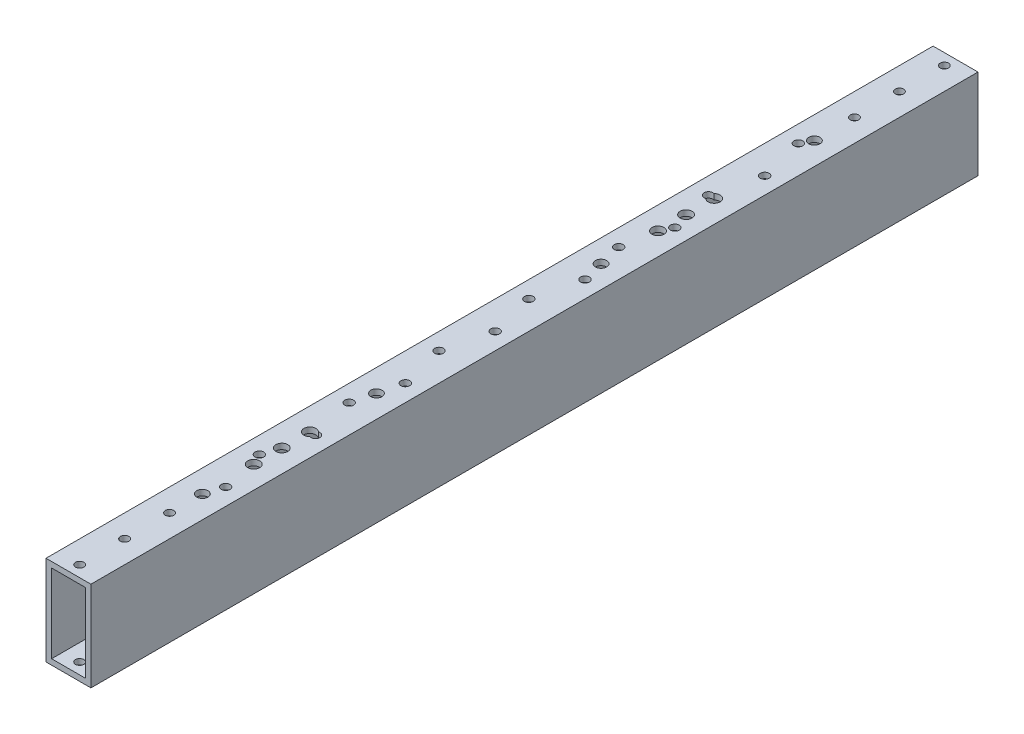
from build123d import *

# Parameters (mm, degrees)
SKETCH1_W                       = 25.4
SKETCH1_H                       = 50.8
SKETCH1_W_2                     = 19.05
SKETCH1_H_2                     = 44.45
EXTRUDE_THIN1_DEPTH             = 501.65
F_3_16_0_1875_DIAMETER_HOLE1_D  = 4.7625
F_1_4_0_25_DIAMETER_HOLE1_D     = 6.35
F_1_4_0_25_DIAMETER_HOLE1_DEPTH = 25.4
F_1_4_0_25_DIAMETER_HOLE1_TIP   = 1.907732465
F_1_4_CLEARANCE_HOLE1_D         = 6.7564
F_1_4_CLEARANCE_HOLE1_DEPTH     = 38.1
F_1_4_CLEARANCE_HOLE1_TIP       = 2.029827343
F_3_16_0_195_DIAMETER_HOLE1_D   = 4.953


with BuildPart() as part:
    # Sketch1 → Extrude-Thin1 (new body)
    with BuildSketch(Plane.XY):
        Rectangle(SKETCH1_W, SKETCH1_H)
        Rectangle(SKETCH1_W_2, SKETCH1_H_2, mode=Mode.SUBTRACT)
    extrude(amount=EXTRUDE_THIN1_DEPTH)

    # 3/16 (0.1875) Diameter Hole1 (through all)
    with Locations(Plane(origin=(0, 25.4, 495.3), x_dir=(1, 0, 0), z_dir=(0, 1, 0))):
        with Locations((0, 0), (0, 488.95), (0, 463.55), (0, 438.15), (0, 25.4), (0, 50.8)):
            Hole(F_3_16_0_1875_DIAMETER_HOLE1_D / 2)

    # 1/4 (0.25) Diameter Hole1
    with Locations(Plane(origin=(0, 25.4, 0), x_dir=(1, 0, 0), z_dir=(0, 1, 0))):
        with Locations((0, -79.831), (0, -425.933853021), (0, -327.499040355), (0, -200.481)):
            Hole(F_1_4_0_25_DIAMETER_HOLE1_D / 2, depth=F_1_4_0_25_DIAMETER_HOLE1_DEPTH)
            with Locations((0, 0, -(F_1_4_0_25_DIAMETER_HOLE1_DEPTH + F_1_4_0_25_DIAMETER_HOLE1_TIP / 2))):  # 118° drill point
                Cone(0, F_1_4_0_25_DIAMETER_HOLE1_D / 2, F_1_4_0_25_DIAMETER_HOLE1_TIP, mode=Mode.SUBTRACT)

    # 1/4 Clearance Hole1
    with Locations(Plane(origin=(381, 25.4, 250.825), x_dir=(1, 0, 0), z_dir=(0, 1, 0))):
        with Locations((381, 82.55), (381, 98.425), (381, 114.3), (381, -146.05), (381, -130.175), (381, -114.3), (-381, -146.05), (-381, -130.175), (-381, -114.3), (-381, 82.55), (-381, 98.425), (-381, 114.3)):
            Hole(F_1_4_CLEARANCE_HOLE1_D / 2, depth=F_1_4_CLEARANCE_HOLE1_DEPTH)
            with Locations((0, 0, -(F_1_4_CLEARANCE_HOLE1_DEPTH + F_1_4_CLEARANCE_HOLE1_TIP / 2))):  # 118° drill point
                Cone(0, F_1_4_CLEARANCE_HOLE1_D / 2, F_1_4_CLEARANCE_HOLE1_TIP, mode=Mode.SUBTRACT)

    # 3/16 (0.195) Diameter Hole1 (through all)
    with Locations(Plane(origin=(0, -25.4, 0), x_dir=(-1, 0, 0), z_dir=(0, -1, 0))):
        with Locations((3.169336228, -85.725), (-3.180663772, -111.125), (3.169336228, -136.525), (-3.180663772, -161.925), (3.169336228, -187.325), (-3.180663772, -212.725), (3.169336228, -238.125), (-3.180663772, -263.525), (3.169336228, -288.925), (-3.180663772, -314.325), (3.169336228, -339.725), (-3.180663772, -365.125), (3.169336228, -390.525), (-3.180663772, -415.925)):
            Hole(F_3_16_0_195_DIAMETER_HOLE1_D / 2)


solid = part.part
